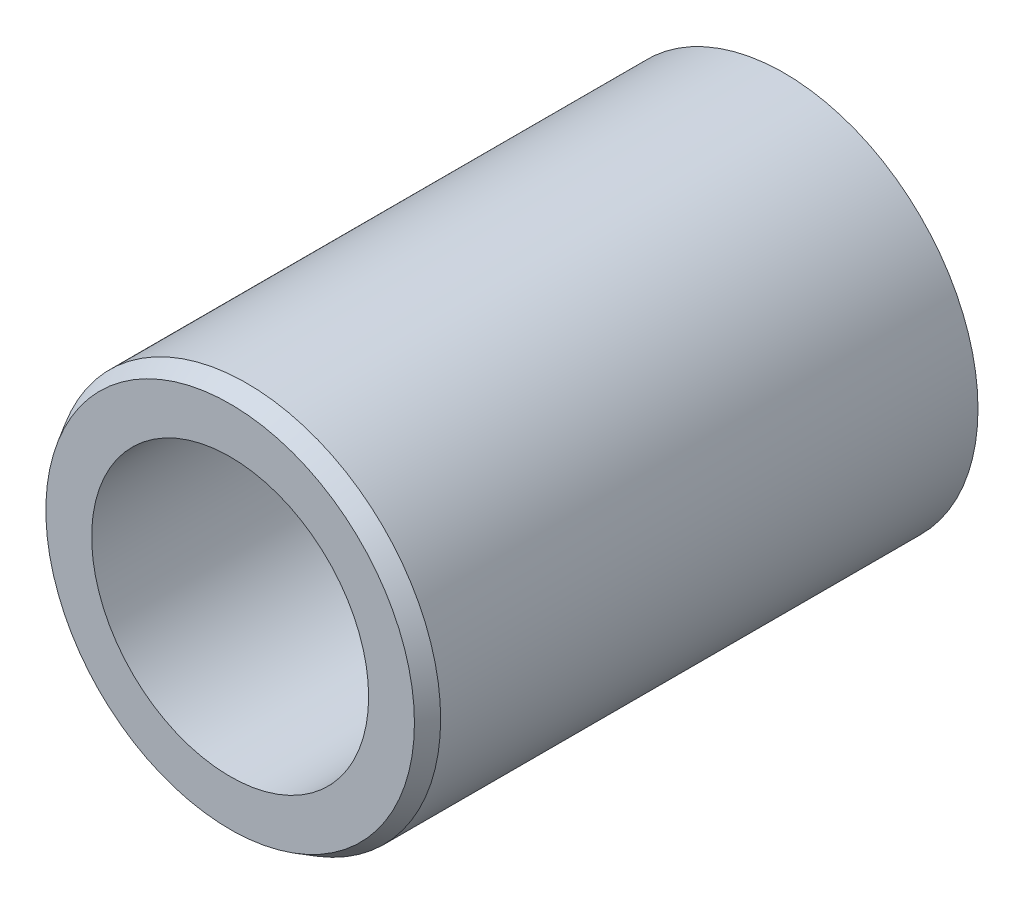
from build123d import *


with BuildPart() as part:
    # Sketch1 → Revolve1 (revolve)
    with BuildSketch(Plane(origin=(0, 0, 0), x_dir=(1, 0, 0), z_dir=(0, 1, 0))):
        Polygon((2.788675135, 0), (2.5, -0.5), (2.5, -10), (3.326794919, -10), (3.5, -9.7), (3.5, 0), align=None)
    revolve(axis=Axis((0, 0, 0), (0, 0, 1)))


solid = part.part
